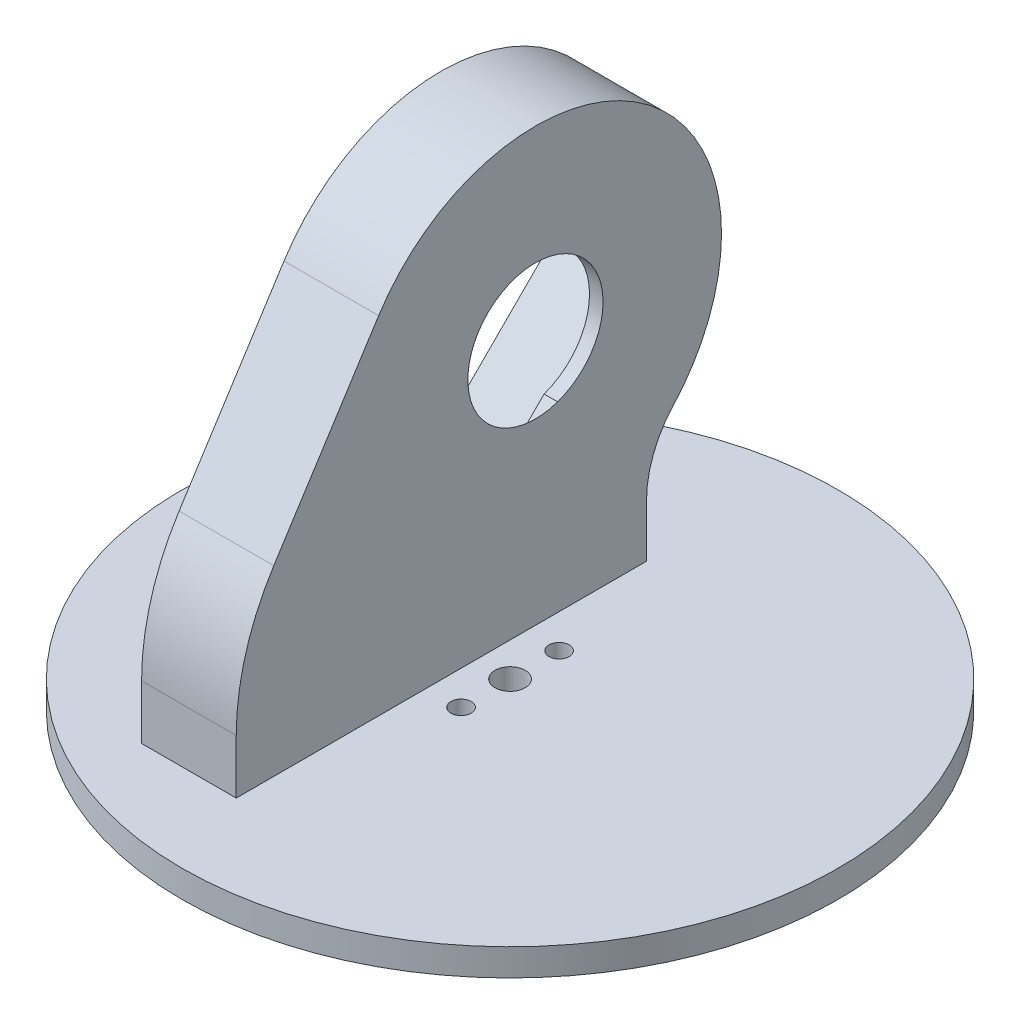
from build123d import *

# Parameters (mm, degrees)
SKETCH1_R                = 48.5
SKETCH1_R_2              = 1.5
SKETCH1_R_3              = 2.235591035
BOSS_EXTRUDE2_DEPTH      = 4
BOSS_EXTRUDE3_DEPTH      = 0.0001
BOSS_EXTRUDE3_DEPTH_BACK = 14
SKETCH6_R                = 10
CUT_EXTRUDE1_DEPTH       = 12
SKETCH11_R               = 1.3
CUT_EXTRUDE3_DEPTH       = 4
CUT_EXTRUDE4_DEPTH       = 2
CUT_EXTRUDE5_DEPTH       = 2


with BuildPart() as part:
    # Sketch1 → Boss-Extrude2 (new body)
    with BuildSketch(Plane(origin=(0, 0, 0), x_dir=(1, 0, 0), z_dir=(0, 1, 0))):
        with Locations(Location((0, 0, 0), (0, 0, 270))):
            Circle(SKETCH1_R)
        with Locations(Location((0, 7.25, 0), (0, 0, 270))):
            Circle(SKETCH1_R_2, mode=Mode.SUBTRACT)
        with Locations(Location((0, -7.25, 0), (0, 0, 270))):
            Circle(SKETCH1_R_2, mode=Mode.SUBTRACT)
        with Locations(Location((0, 0, 0), (0, 0, 270))):
            Circle(SKETCH1_R_3, mode=Mode.SUBTRACT)
    extrude(amount=BOSS_EXTRUDE2_DEPTH)

    # Sketch6 → Boss-Extrude3 (add, two sides: drawn at the far end of the back side and taken through both)
    with BuildSketch(Plane(origin=(-5, 0, 0), x_dir=(0, 0, -1), z_dir=(1, 0, 0)).offset(-BOSS_EXTRUDE3_DEPTH_BACK)):
        with BuildLine():
            Line((25.18, 4), (-35.5, 4))
            Line((-35.5, 4), (-35.5, 12.01726107))
            ThreePointArc((-35.5, 12.01726107), (-34.084736696, 21.902425823), (-29.952654999, 30.993374798))
            Line((-29.952654999, 30.993374798), (-14.438105641, 55.261411059))
            ThreePointArc((-14.438105641, 55.261411059), (25.491097233, 62.28169582), (29.092718415, 21.900339167))
            ThreePointArc((29.092718415, 21.900339167), (26.192340729, 17.214399439), (25.18, 11.79726107))
            Line((25.18, 11.79726107), (25.18, 4))
        make_face()
        with Locations((8.75, 40.43726107)):
            Circle(SKETCH6_R, mode=Mode.SUBTRACT)
    extrude(amount=BOSS_EXTRUDE3_DEPTH + BOSS_EXTRUDE3_DEPTH_BACK)

    # Sketch9 → Cut-Extrude1 (cut)
    with BuildSketch(Plane.ZY.offset(19)):
        Polygon((5.568912319, 11.269106346), (20.418154724, 26.118348751), (-8.573223305, 55.109726779), (-23.42246571, 40.260484374), align=None)
    extrude(amount=-CUT_EXTRUDE1_DEPTH, mode=Mode.SUBTRACT)

    # Sketch11 → Cut-Extrude3 (cut)
    with BuildSketch(Plane.ZY.offset(19)):
        with Locations((-15.14931637, 53.907645251)):
            Circle(SKETCH11_R)
        with Locations(Location((-22.220384182, 46.836577439, 0), (0, 0, 180))):
            Circle(SKETCH11_R)
        with Locations((12.145005384, 12.471187874)):
            Circle(SKETCH11_R)
        with Locations(Location((19.216073196, 19.542255686, 0), (0, 0, 180))):
            Circle(SKETCH11_R)
    extrude(amount=-CUT_EXTRUDE3_DEPTH, mode=Mode.SUBTRACT)

    # Sketch16 → Cut-Extrude4 (cut)
    with BuildSketch(Plane.ZY.offset(19)):
        with BuildLine():
            Line((-16.875075084, 4), (28.737520082, 4))
            add(Edge.make_bspline(
                [(-16.875075084, 4), (-17.737013272, 15.160077135), (-34.124977495, 25.159288994), (-33.933000746, 51.000691554), (-17.215111481, 67.555057226), (7.98292021, 62.524626035), (20.715664688, 35.805630134), (37.029137104, 21.254502483), (28.737520082, 4)],
                knots=[0, 0, 0, 0, 0.199147198, 0.31666239, 0.448197293, 0.600919397, 0.725180292, 1, 1, 1, 1], degree=3))
        make_face()
    extrude(amount=-CUT_EXTRUDE4_DEPTH, mode=Mode.SUBTRACT)

    # Sketch18 → Cut-Extrude5 (cut)
    with BuildSketch(Plane.ZY.offset(7)):
        with BuildLine():
            Line((11.727812383, 19.959448687), (8.856958852, 22.830302218))
            Line((8.856958852, 22.830302218), (5.98610532, 19.959448687))
            ThreePointArc((5.98610532, 19.959448687), (8.856958852, 18.770302218), (11.727812383, 19.959448687))
        make_face()
        with BuildLine():
            Line((11.727812383, 25.70115575), (8.856958852, 22.830302218))
            Line((8.856958852, 22.830302218), (11.727812383, 19.959448687))
            ThreePointArc((11.727812383, 19.959448687), (12.916958852, 22.830302218), (11.727812383, 25.70115575))
        make_face()
        with BuildLine():
            ThreePointArc((1.25, 40.43726107), (0.488795325, 36.610426746), (-1.678932188, 33.366193258))
            Line((-1.678932188, 33.366193258), (8.856958852, 22.830302218))
            Line((8.856958852, 22.830302218), (11.727812383, 25.70115575))
            Line((11.727812383, 25.70115575), (15.220919882, 29.194263249))
            Line((15.220919882, 29.194263249), (0.696168032, 43.719015099))
            ThreePointArc((0.696168032, 43.719015099), (1.110569971, 42.101340346), (1.25, 40.43726107))
        make_face()
        with BuildLine():
            Line((8.856958852, 22.830302218), (-1.678932188, 33.366193258))
            ThreePointArc((-1.678932188, 33.366193258), (-6.513932022, 30.690466725), (-12.031754029, 30.991093038))
            Line((-12.031754029, 30.991093038), (2.492997821, 16.466341187))
            Line((2.492997821, 16.466341187), (5.98610532, 19.959448687))
            Line((5.98610532, 19.959448687), (8.856958852, 22.830302218))
        make_face()
    extrude(amount=-CUT_EXTRUDE5_DEPTH, mode=Mode.SUBTRACT)


solid = part.part
